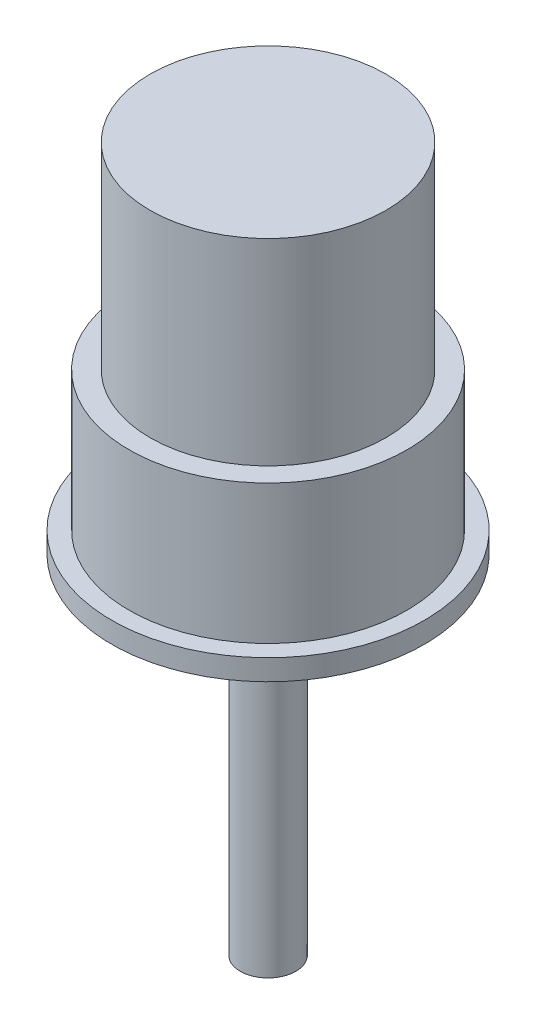
from build123d import *


with BuildPart() as part:
    # Sketch2 → Revolve1 (revolve)
    with BuildSketch(Plane.XY, mode=Mode.PRIVATE) as revolve1_sk:
        Polygon((0, 0), (-16.9815, 0), (-16.9815, -28.34), (-20, -28.34), (-20, -48.34), (-22.5, -48.34), (-22.5, -51.34), (-4, -51.34), (-4, -101.34), (0, -101.34), align=None)
    revolve(revolve1_sk.sketch.rotate(Axis((0, 0, 0), (0, 1, 0)), 270), axis=Axis((0, 0, 0), (0, 1, 0)))


solid = part.part
